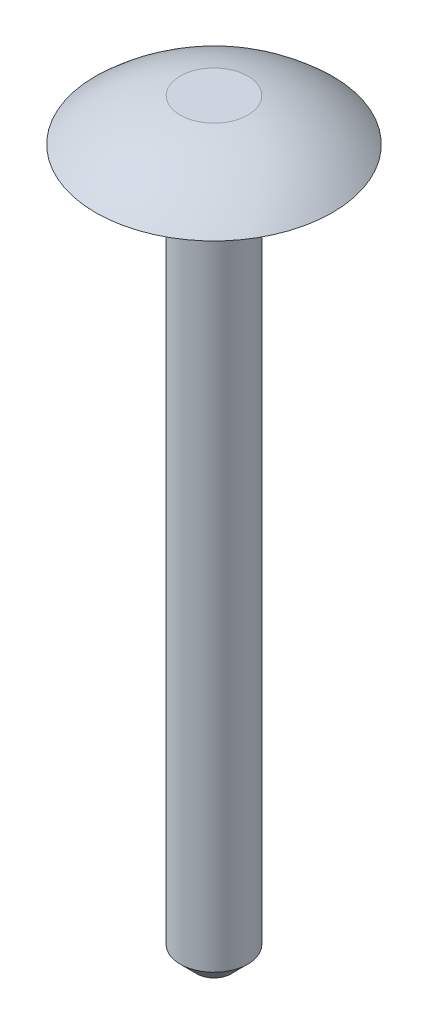
from build123d import *

# Parameters (mm, degrees)
SKETCH_19_R     = 2
EXTRUDE_1_DEPTH = 42
CHAMFER_1_SIZE  = 1


with BuildPart() as part:
    # 草图16 → 旋转1 (revolve)
    with BuildSketch(Plane.XY):
        with BuildLine():
            Line((0, 0), (-7, 0))
            add(Edge.make_bspline(
                [(-2, 2.5), (-4.820865147, 1.972200791), (-7, 0)],
                knots=[0, 0, 0, 1, 1, 1], degree=2))
            Line((-2, 2.5), (0, 2.5))
            Line((0, 2.5), (0, 0))
        make_face()
    revolve(axis=Axis((0, 0, 0), (0, 1, 0)))

    # 草图19 → 凸台-拉伸1 (add)
    with BuildSketch(Plane(origin=(0, 0, 0), x_dir=(1, 0, 0), z_dir=(0, 1, 0))):
        with Locations(Location((0, 0, 0), (0, 0, 270))):
            Circle(SKETCH_19_R)
    extrude(amount=-EXTRUDE_1_DEPTH)

    # 倒角1
    chamfer_1_edges = [part.edges().sort_by_distance(p)[0] for p in [
        (0, -42, -2),
        (0, 0, -2),
    ]]
    chamfer(chamfer_1_edges, length=CHAMFER_1_SIZE)


solid = part.part
